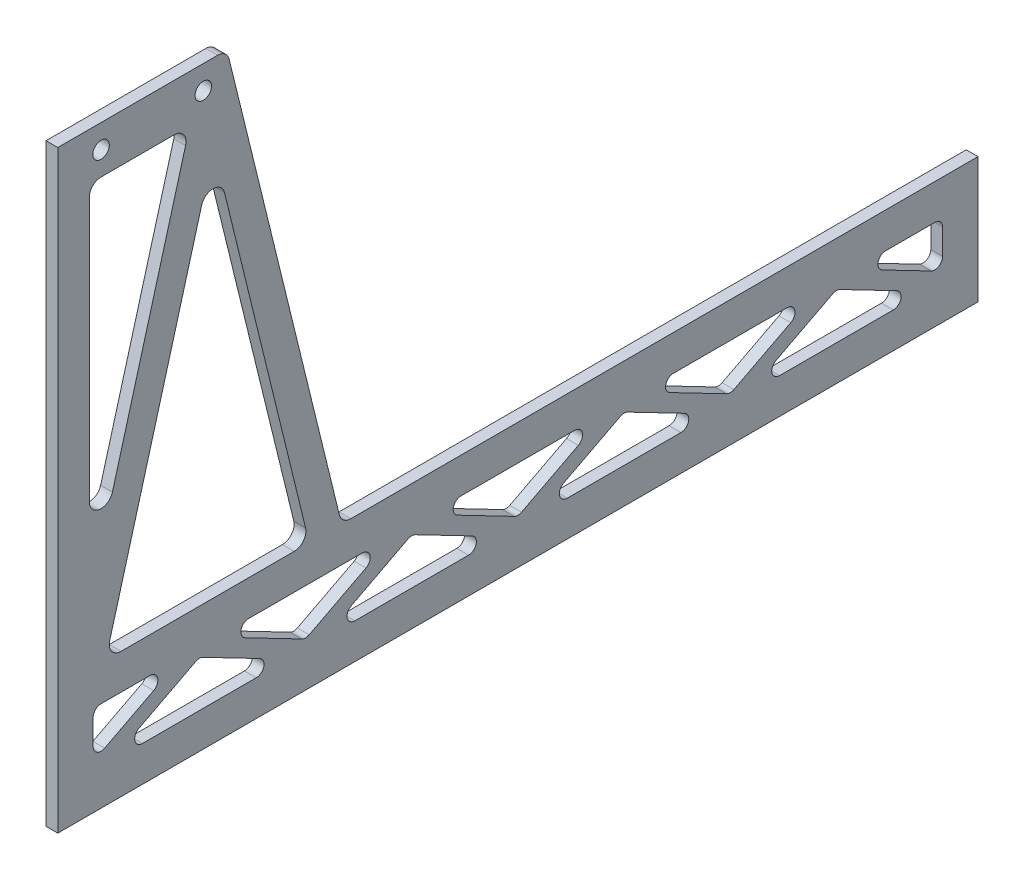
from build123d import *

# Parameters (mm, degrees)
SKETCH1_R           = 1.05
BOSS_EXTRUDE1_DEPTH = 1.5
FILLET1_R           = 1.5
SKETCH2_W           = 117
SKETCH2_H           = 16
BOSS_EXTRUDE2_DEPTH = 1.5
CUT_EXTRUDE2_DEPTH  = 140.253366207
FILLET3_R           = 1
CUT_EXTRUDE3_DEPTH  = 140.253366207
BOSS_EXTRUDE3_DEPTH = 1.5
FILLET5_R           = 1.5


with BuildPart() as part:
    # Sketch1 → Boss-Extrude1 (new body)
    with BuildSketch(Plane(origin=(0, 0, 0), x_dir=(0, 0, -1), z_dir=(1, 0, 0))):
        Polygon((0, 0), (0, 75.5), (21.5, 75.5), (40, 0), (35.881667859, 0), (29.755840045, 25), (4, 25), (4, 0), align=None)
        with Locations((5.5, 72.5)):
            Circle(SKETCH1_R, mode=Mode.SUBTRACT)
        with Locations((18.5, 72.5)):
            Circle(SKETCH1_R, mode=Mode.SUBTRACT)
        Polygon((4, 69.5), (18.851866535, 69.5), (4, 29), align=None, mode=Mode.SUBTRACT)
        Polygon((8.260475549, 29), (20.558388216, 62.535546651), (28.775707595, 29), align=None, mode=Mode.SUBTRACT)
    extrude(amount=BOSS_EXTRUDE1_DEPTH)

    # Fillet1
    fillet1_edges = [part.edges().sort_by_distance(p)[0] for p in [
        (0.75, 75.5, -21.5),
        (0.75, 25, -29.755840045),
        (0.75, 25, -4),
        (0.75, 69.5, -4),
        (0.75, 29, -4),
        (0.75, 69.5, -18.851866535),
        (0.75, 29, -8.260475549),
        (0.75, 29, -28.775707595),
        (0.75, 62.535546651, -20.558388216),
    ]]
    fillet(fillet1_edges, radius=FILLET1_R)

    # Sketch2 → Boss-Extrude2 (add)
    with BuildSketch(Plane(origin=(1.5, 0, 0), x_dir=(0, 0, -1), z_dir=(1, 0, 0))):
        with Locations((58.5, 8)):
            Rectangle(SKETCH2_W, SKETCH2_H)
    extrude(amount=-BOSS_EXTRUDE2_DEPTH)

    # Sketch5 → Cut-Extrude2 (cut, through all)
    with BuildSketch(Plane(origin=(1.5, 0, 0), x_dir=(0, 0, -1), z_dir=(1, 0, 0))):
        Polygon((4.5, 11.5), (15.827584811, 11.5), (4.5, 5.626437506), align=None)
        Polygon((112.5, 11.5), (112.5, 5.626437506), (101.172415189, 11.5), align=None)
        Polygon((6.672415189, 4.5), (29.327584811, 4.5), (18, 10.373562494), align=None)
        Polygon((33.672415189, 4.5), (56.327584811, 4.5), (45, 10.373562494), align=None)
        Polygon((60.672415189, 4.5), (83.327584811, 4.5), (72, 10.373562494), align=None)
        Polygon((87.672415189, 4.5), (110.327584811, 4.5), (99, 10.373562494), align=None)
        Polygon((20.172415189, 11.5), (42.827584811, 11.5), (31.5, 5.626437506), align=None)
        Polygon((47.172415189, 11.5), (69.827584811, 11.5), (58.5, 5.626437506), align=None)
        Polygon((85.5, 5.626437506), (96.827584811, 11.5), (74.172415189, 11.5), align=None)
    extrude(amount=-CUT_EXTRUDE2_DEPTH, mode=Mode.SUBTRACT)

    # Fillet3
    fillet3_edges = [part.edges().sort_by_distance(p)[0] for p in [
        (0.75, 4.5, -56.327584811),
        (0.75, 4.5, -33.672415189),
        (0.75, 10.373562494, -45),
        (0.75, 5.626437506, -58.5),
        (0.75, 11.5, -47.172415189),
        (0.75, 11.5, -69.827584811),
        (0.75, 4.5, -29.327584811),
        (0.75, 4.5, -6.672415189),
        (0.75, 10.373562494, -18),
        (0.75, 5.626437506, -31.5),
        (0.75, 11.5, -20.172415189),
        (0.75, 11.5, -42.827584811),
        (0.75, 4.5, -110.327584811),
        (0.75, 4.5, -87.672415189),
        (0.75, 10.373562494, -99),
        (0.75, 5.626437506, -112.5),
        (0.75, 11.5, -101.172415189),
        (0.75, 11.5, -112.5),
        (0.75, 4.5, -83.327584811),
        (0.75, 4.5, -60.672415189),
        (0.75, 10.373562494, -72),
        (0.75, 5.626437506, -85.5),
        (0.75, 11.5, -74.172415189),
        (0.75, 11.5, -96.827584811),
        (0.75, 5.626437506, -4.5),
        (0.75, 11.5, -4.5),
        (0.75, 11.5, -15.827584811),
    ]]
    fillet(fillet3_edges, radius=FILLET3_R)

    # Sketch6 → Cut-Extrude3 (cut, through all)
    with BuildSketch(Plane(origin=(1.5, 0, 0), x_dir=(0, 0, -1), z_dir=(1, 0, 0))):
        Polygon((30.998526841, 19.928494428), (18.851866535, 69.5), (4, 69.5), (4, 19.75), align=None)
    extrude(amount=-CUT_EXTRUDE3_DEPTH, mode=Mode.SUBTRACT)

    # Sketch7 → Boss-Extrude3 (add)
    with BuildSketch(Plane(origin=(1.5, 0, 0), x_dir=(0, 0, -1), z_dir=(1, 0, 0))):
        Polygon((16.776232149, 69.5), (4, 23.476934928), (4, 16), (6.075634386, 16), (19.825004849, 65.528543637), (18.851866535, 69.5), align=None)
    extrude(amount=-BOSS_EXTRUDE3_DEPTH)

    # Fillet5
    fillet5_edges = [part.edges().sort_by_distance(p)[0] for p in [
        (0.75, 16, -31.961138058),
        (0.75, 16, -36.079470199),
        (0.75, 69.5, -4),
        (0.75, 69.5, -16.776232149),
        (0.75, 23.476934928, -4),
        (0.75, 16, -6.075634386),
        (0.75, 65.528543637, -19.825004849),
    ]]
    fillet(fillet5_edges, radius=FILLET5_R)


solid = part.part
